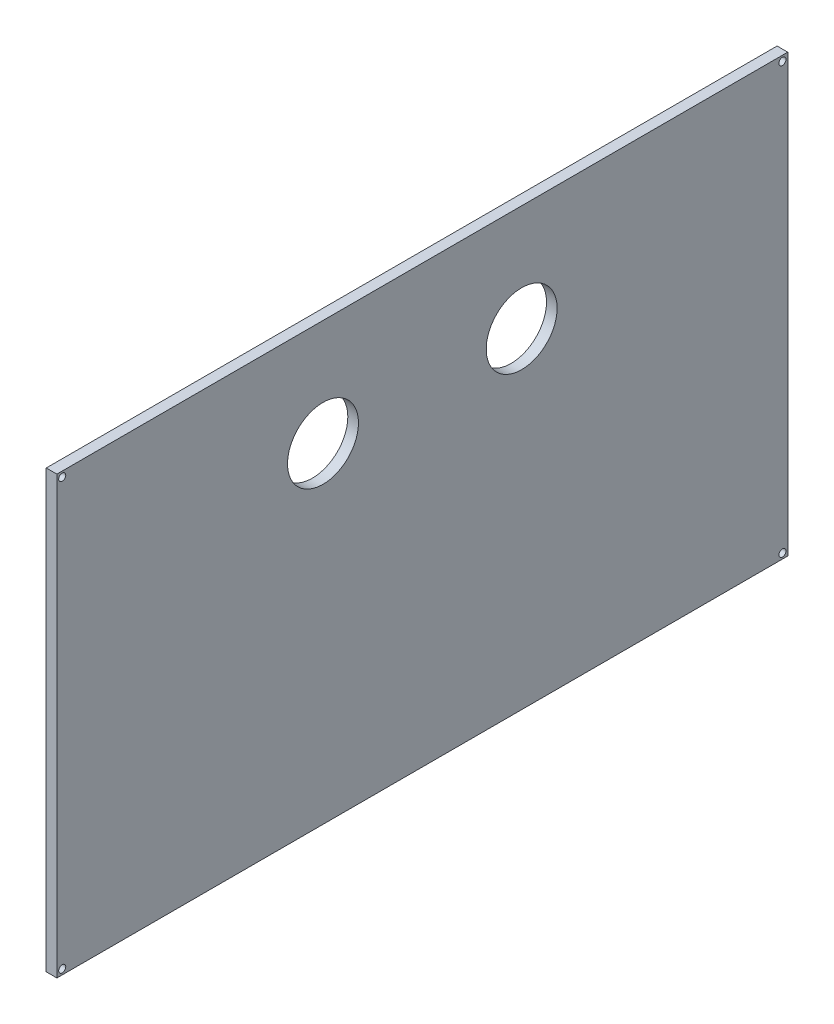
from build123d import *

# Parameters (mm, degrees)
SKETCH1_W           = 206
SKETCH1_H           = 123
SKETCH1_R           = 10
SKETCH1_R_2         = 1
BOSS_EXTRUDE1_DEPTH = 3


with BuildPart() as part:
    # Sketch1 → Boss-Extrude1 (new body)
    with BuildSketch(Plane(origin=(0, 0, 0), x_dir=(0, 0, -1), z_dir=(1, 0, 0))):
        with Locations((103, 61.5)):
            Rectangle(SKETCH1_W, SKETCH1_H)
        with Locations((75, 93)):
            Circle(SKETCH1_R, mode=Mode.SUBTRACT)
        with Locations((131, 93)):
            Circle(SKETCH1_R, mode=Mode.SUBTRACT)
        with Locations((204.5, 1.5)):
            Circle(SKETCH1_R_2, mode=Mode.SUBTRACT)
        with Locations((1.5, 1.5)):
            Circle(SKETCH1_R_2, mode=Mode.SUBTRACT)
        with Locations((204.5, 121.5)):
            Circle(SKETCH1_R_2, mode=Mode.SUBTRACT)
        with Locations((1.5, 121.5)):
            Circle(SKETCH1_R_2, mode=Mode.SUBTRACT)
    extrude(amount=BOSS_EXTRUDE1_DEPTH)


solid = part.part
